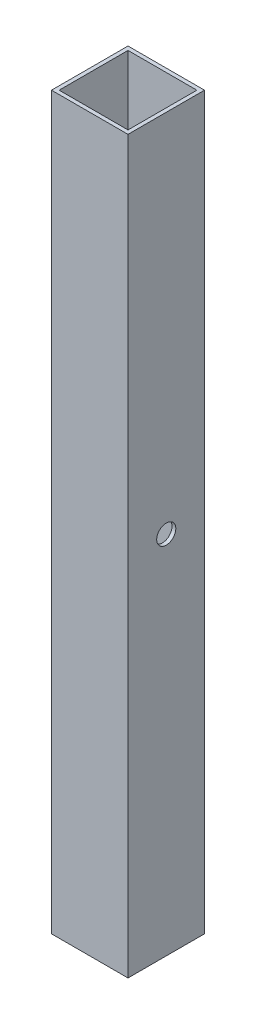
from build123d import *

# Parameters (mm, degrees)
SKETCH1_W               = 20
SKETCH1_H               = 20
SKETCH1_W_2             = 18
SKETCH1_H_2             = 18
BOSS_EXTRUDE1_DEPTH     = 191
CUT_EXTRUDE1_DEPTH      = 193.304446126
CUT_EXTRUDE1_DEPTH_BACK = 193.304446126
SKETCH2_R               = 2.5


with BuildPart() as part:
    # Sketch1 → Boss-Extrude1 (new body)
    with BuildSketch(Plane(origin=(0, 0, 0), x_dir=(1, 0, 0), z_dir=(0, 1, 0))):
        Rectangle(SKETCH1_W, SKETCH1_H)
        Rectangle(SKETCH1_W_2, SKETCH1_H_2, mode=Mode.SUBTRACT)
    extrude(amount=BOSS_EXTRUDE1_DEPTH)

    # Sketch2 → Cut-Extrude1 (cut, two sides: drawn at the far end of the back side and taken through both)
    with BuildSketch(Plane.ZY.offset(10).offset(-CUT_EXTRUDE1_DEPTH_BACK)):
        with Locations(Location((0, 95.5, 0), (0, 0, 180))):
            Circle(SKETCH2_R)
    extrude(amount=CUT_EXTRUDE1_DEPTH + CUT_EXTRUDE1_DEPTH_BACK, mode=Mode.SUBTRACT)


solid = part.part
